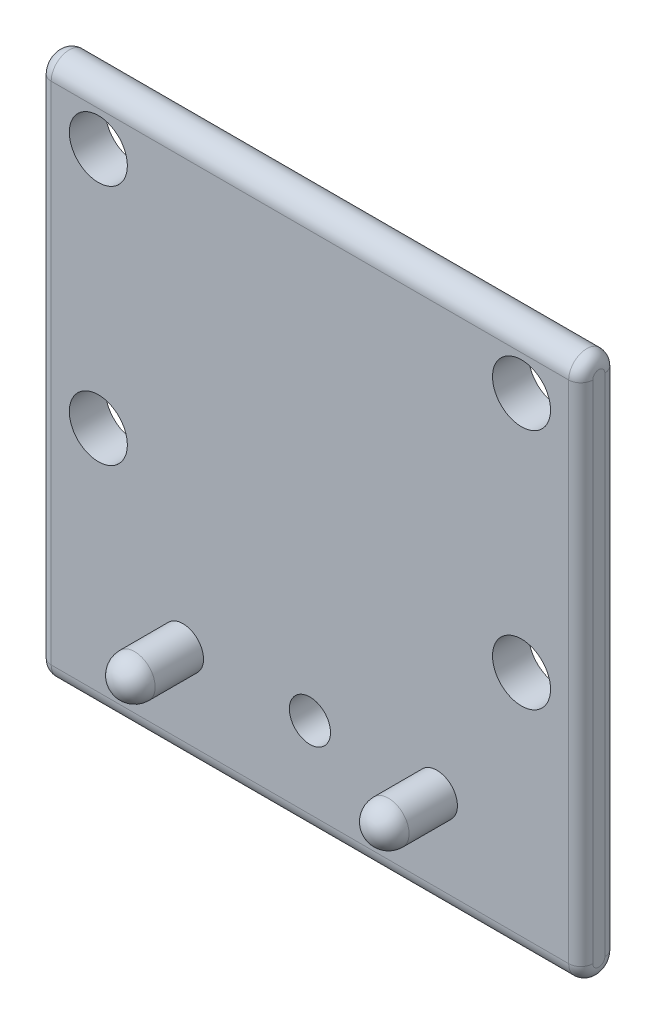
from build123d import *

# Parameters (mm, degrees)
SKETCH1_W            = 44.8
SKETCH1_H            = 2.99
BOSS_EXTRUDE1_DEPTH  = 44.8
FILLET1_RADIUS       = 1.495
FILLET1_LENGTH       = 44.8
M4_CLEARANCE_HOLE1_D = 4.8
M3_CLEARANCE_HOLE1_D = 3.4
SKETCH8_R            = 1.7
BOSS_EXTRUDE2_DEPTH  = 4
REVOLVE1_ANGLE       = 180
REVOLVE2_ANGLE       = 180
FILLET2_RADIUS       = 1.495
FILLET2_LENGTH       = 44.8
FILLET3_R            = 1
FILLET4_R            = 1


with BuildPart() as part:
    # Sketch1 → Boss-Extrude1 (new body)
    with BuildSketch(Plane(origin=(0, 0, 0), x_dir=(1, 0, 0), z_dir=(0, 1, 0))):
        Rectangle(SKETCH1_W, SKETCH1_H)
    extrude(amount=BOSS_EXTRUDE1_DEPTH)

    # Fillet1: full round fillet: the end face becomes a half cylinder, R = half its width
    fillet1_face = Plane((0, 0, 0), x_dir=(-1, 0, 0), z_dir=(0, -1, 0))  # on the end face: x along it, z out of the body
    fillet1_slab = fillet1_face.offset(-FILLET1_RADIUS / 2) * Box(FILLET1_LENGTH, 2 * FILLET1_RADIUS, FILLET1_RADIUS, mode=Mode.PRIVATE)  # the body's end, R deep
    fillet1_round = Plane((0, 1.495, 0), x_dir=(0, -1, 0), z_dir=(-1, 0, 0)) * Cylinder(FILLET1_RADIUS, FILLET1_LENGTH, mode=Mode.PRIVATE)  # its axis R under the face
    add(fillet1_slab - fillet1_round, mode=Mode.SUBTRACT)

    # M4 Clearance Hole1 (through all)
    with Locations(Plane.XY.offset(1.495)):
        with Locations((-17.5, 40.4), (-17.5, 20.4), (17.5, 20.4), (17.5, 40.4)):
            Hole(M4_CLEARANCE_HOLE1_D / 2)

    # M3 Clearance Hole1 (through all)
    with Locations(Plane.XY.offset(1.495)):
        with Locations((0, 8.2)):
            Hole(M3_CLEARANCE_HOLE1_D / 2)

    # Sketch8 → Boss-Extrude2 (add)
    with BuildSketch(Plane.XY.offset(1.495)):
        with Locations(Location((-10.5, 8.2, 0), (0, 0, 180))):
            Circle(SKETCH8_R)
        with Locations(Location((10.5, 8.2, 0), (0, 0, 180))):
            Circle(SKETCH8_R)
    extrude(amount=BOSS_EXTRUDE2_DEPTH)

    # Sketch9 → Revolve1 (revolve)
    with BuildSketch(Plane.XY.offset(5.495)):
        with BuildLine():
            Line((-10.5, 9.9), (-10.5, 6.5))
            ThreePointArc((-10.5, 6.5), (-8.8, 8.2), (-10.5, 9.9))
        make_face()
    revolve(axis=Axis((-10.5, 9.9, 5.495), (0, -1, 0)), revolution_arc=REVOLVE1_ANGLE)

    # Sketch10 → Revolve2 (revolve)
    with BuildSketch(Plane.XY.offset(5.495)):
        with BuildLine():
            Line((10.5, 9.9), (10.5, 6.5))
            ThreePointArc((10.5, 6.5), (12.2, 8.2), (10.5, 9.9))
        make_face()
    revolve(axis=Axis((10.5, 9.9, 5.495), (0, -1, 0)), revolution_arc=REVOLVE2_ANGLE)

    # Fillet2: full round fillet: the end face becomes a half cylinder, R = half its width
    fillet2_face = Plane((0, 44.8, 0), x_dir=(1, 0, 0), z_dir=(0, 1, 0))  # on the end face: x along it, z out of the body
    fillet2_slab = fillet2_face.offset(-FILLET2_RADIUS / 2) * Box(FILLET2_LENGTH, 2 * FILLET2_RADIUS, FILLET2_RADIUS, mode=Mode.PRIVATE)  # the body's end, R deep
    fillet2_round = Plane((0, 43.305, 0), x_dir=(0, 1, 0), z_dir=(1, 0, 0)) * Cylinder(FILLET2_RADIUS, FILLET2_LENGTH, mode=Mode.PRIVATE)  # its axis R under the face
    add(fillet2_slab - fillet2_round, mode=Mode.SUBTRACT)

    # Fillet3
    fillet3_edges = [part.edges().sort_by_distance(p)[0] for p in [
        (-22.4, 0, 0),
        (-22.4, 22.4, 1.495),
        (-22.4, 22.4, -1.495),
        (-22.4, 44.8, 0),
    ]]
    fillet(fillet3_edges, radius=FILLET3_R)

    # Fillet4
    fillet4_edges = [part.edges().sort_by_distance(p)[0] for p in [
        (22.4, 0, 0),
        (22.4, 22.4, 1.495),
        (22.4, 22.4, -1.495),
        (22.4, 44.8, 0),
    ]]
    fillet(fillet4_edges, radius=FILLET4_R)


solid = part.part
